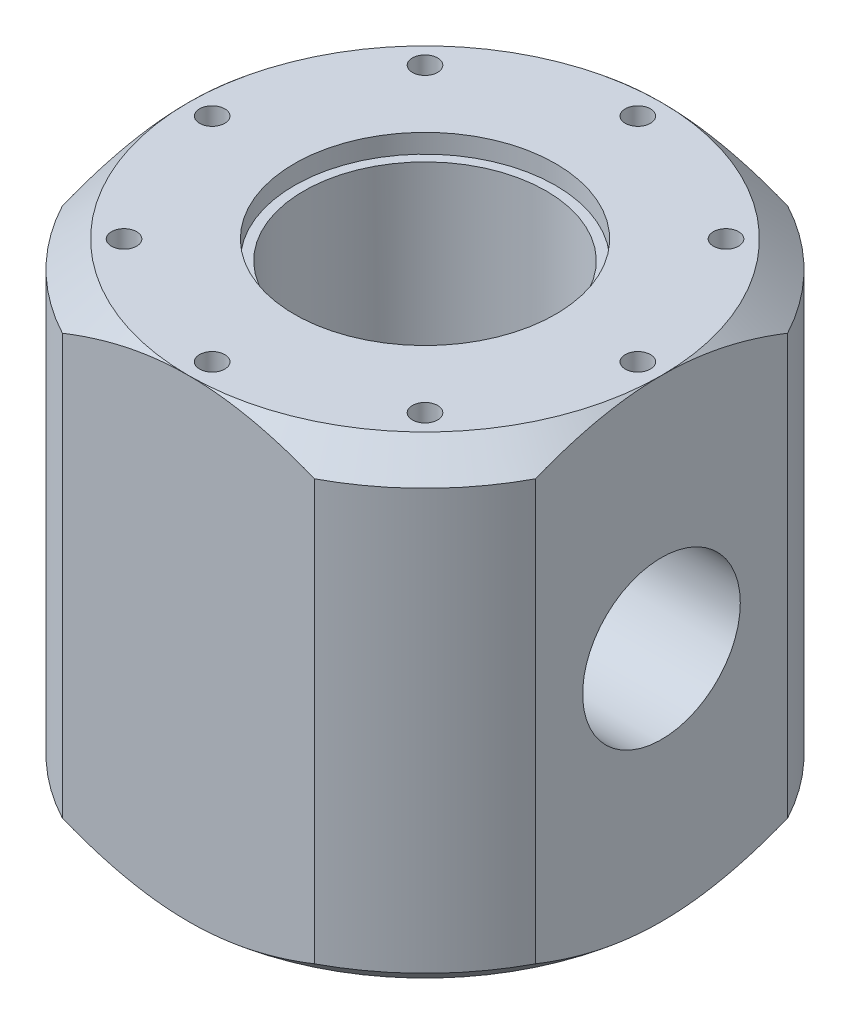
from build123d import *

# Parameters (mm, degrees)
SKETCH1_W               = 75
SKETCH1_H               = 75
BOSS_EXTRUDE1_DEPTH     = 75
SKETCH2_R               = 5.35
CUT_EXTRUDE1_DEPTH      = 92.855865354
SKETCH5_R               = 12.5
CUT_EXTRUDE2_DEPTH      = 113.5
SKETCH7_R               = 20.71
SKETCH7_R_2             = 19.21
CUT_EXTRUDE3_DEPTH      = 3
SKETCH11_R              = 2
CUT_EXTRUDE4_DEPTH      = 10
SKETCH12_OUTSIDE_W      = 102.98
SKETCH12_OUTSIDE_H      = 102.98
SKETCH12_OUTSIDE_R      = 42.5
CUT_EXTRUDE6_DEPTH      = 92.855865477
SKETCH13_R              = 19.21
CUT_EXTRUDE7_DEPTH      = 50
SKETCH16_OUTSIDE_W      = 126.816
SKETCH16_OUTSIDE_H      = 126.816
SKETCH16_OUTSIDE_R      = 37.5
CUT_EXTRUDE8_DEPTH      = 10
CUT_EXTRUDE8_DRAFT      = 50
MIRROR2_COPY_1_SKETCH_W = 126.816
MIRROR2_COPY_1_SKETCH_H = 126.816
MIRROR2_COPY_1_SKETCH_R = 37.5
MIRROR2_COPY_1_DEPTH    = 10
MIRROR2_COPY_1_DRAFT    = 50


with BuildPart() as part:
    # Sketch1 → Boss-Extrude1 (new body)
    with BuildSketch(Plane(origin=(0, 0, 0), x_dir=(1, 0, 0), z_dir=(0, 1, 0))):
        Rectangle(SKETCH1_W, SKETCH1_H)
    extrude(amount=BOSS_EXTRUDE1_DEPTH)

    # Sketch2 → Cut-Extrude1 (cut, through all)
    with BuildSketch(Plane(origin=(0, 0, 0), x_dir=(-1, 0, 0), z_dir=(0, -1, 0))):
        with Locations(Location((0, 0, 0), (0, 0, 90))):
            Circle(SKETCH2_R)
    extrude(amount=-CUT_EXTRUDE1_DEPTH, mode=Mode.SUBTRACT)

    # Sketch5 → Cut-Extrude2 (cut, through all)
    with BuildSketch(Plane(origin=(37.5, 0, 0), x_dir=(0, 0, -1), z_dir=(1, 0, 0))):
        with Locations((0, 37.5)):
            Circle(SKETCH5_R)
    extrude(amount=-CUT_EXTRUDE2_DEPTH, mode=Mode.SUBTRACT)

    # Sketch7 → Cut-Extrude3 (cut)
    with BuildSketch(Plane.XZ):
        with Locations(Location((0, 0, 0), (0, 0, 270))):
            Circle(SKETCH7_R)
        with Locations(Location((0, 0, 0), (0, 0, 270))):
            Circle(SKETCH7_R_2, mode=Mode.SUBTRACT)
    cut_extrude3 = extrude(amount=-CUT_EXTRUDE3_DEPTH, mode=Mode.SUBTRACT)

    # Sketch11 → Cut-Extrude4 (cut)
    with BuildSketch(Plane.XZ):
        with Locations(Location((-33.75, 0, 0), (0, 0, 270))):
            Circle(SKETCH11_R)
        with Locations(Location((-23.864853865, 23.864853865, 0), (0, 0, 270))):
            Circle(SKETCH11_R)
        with Locations(Location((0, 33.75, 0), (0, 0, 270))):
            Circle(SKETCH11_R)
        with Locations(Location((23.864853865, 23.864853865, 0), (0, 0, 270))):
            Circle(SKETCH11_R)
        with Locations(Location((33.75, 0, 0), (0, 0, 270))):
            Circle(SKETCH11_R)
        with Locations(Location((23.864853865, -23.864853865, 0), (0, 0, 270))):
            Circle(SKETCH11_R)
        with Locations(Location((0, -33.75, 0), (0, 0, 270))):
            Circle(SKETCH11_R)
        with Locations(Location((-23.864853865, -23.864853865, 0), (0, 0, 270))):
            Circle(SKETCH11_R)
    cut_extrude4 = extrude(amount=-CUT_EXTRUDE4_DEPTH, mode=Mode.SUBTRACT)

    # Mirror1: Cut-Extrude3, Cut-Extrude4 across plane
    add(cut_extrude3.mirror(Plane.ZX.offset(37.5)), mode=Mode.SUBTRACT)
    add(cut_extrude4.mirror(Plane.ZX.offset(37.5)), mode=Mode.SUBTRACT)

    # Sketch12 outside → Cut-Extrude6 (cut, through all)
    with BuildSketch(Plane.XZ):
        Rectangle(SKETCH12_OUTSIDE_W, SKETCH12_OUTSIDE_H)
        Circle(SKETCH12_OUTSIDE_R, mode=Mode.SUBTRACT)
    extrude(amount=-CUT_EXTRUDE6_DEPTH, mode=Mode.SUBTRACT)

    # Sketch13 → Cut-Extrude7 (cut)
    with BuildSketch(Plane(origin=(0, 75, 0), x_dir=(1, 0, 0), z_dir=(0, 1, 0))):
        with Locations(Location((0, 0, 0), (0, 0, 90))):
            Circle(SKETCH13_R)
    extrude(amount=-CUT_EXTRUDE7_DEPTH, mode=Mode.SUBTRACT)


with BuildPart() as cut_extrude8_tool:
    # Sketch16 outside → Cut-Extrude8 (with draft: the straight prism first)
    with BuildSketch(Plane(origin=(0, 0, 0), x_dir=(1, 0, 0), z_dir=(0, 1, 0))):
        Rectangle(SKETCH16_OUTSIDE_W, SKETCH16_OUTSIDE_H)
        Circle(SKETCH16_OUTSIDE_R, mode=Mode.SUBTRACT)
    extrude(amount=CUT_EXTRUDE8_DEPTH)
    # Cut-Extrude8: the draft: its side faces are tilted about the plane it starts from
    cut_extrude8_sides = [cut_extrude8_tool.faces().sort_by_distance(p)[0] for p in [
        (0, 5, 63.408),
        (63.408, 5, 0),
        (0, 5, -63.408),
        (-63.408, 5, 0),
        (-37.5, 5, 0),
    ]]
    draft(cut_extrude8_sides, Plane(origin=(0, 0, 0), x_dir=(1, 0, 0), z_dir=(0, 1, 0)), CUT_EXTRUDE8_DRAFT)


with BuildPart() as part_1:
    add(part.part)

    # Cut-Extrude8: cut by cut_extrude8_tool
    add(cut_extrude8_tool.part, mode=Mode.SUBTRACT)


with BuildPart() as mirror2_copy_1_tool:
    # Mirror2 copy 1 sketch → Mirror2 copy 1 (with draft: the straight prism first)
    with BuildSketch(Plane.XZ.offset(-75)):
        Rectangle(MIRROR2_COPY_1_SKETCH_W, MIRROR2_COPY_1_SKETCH_H)
        Circle(MIRROR2_COPY_1_SKETCH_R, mode=Mode.SUBTRACT)
    extrude(amount=MIRROR2_COPY_1_DEPTH)
    # Mirror2 copy 1: the draft: its side faces are tilted about the plane it starts from
    mirror2_copy_1_sides = [mirror2_copy_1_tool.faces().sort_by_distance(p)[0] for p in [
        (0, 70, 63.408),
        (63.408, 70, 0),
        (0, 70, -63.408),
        (-63.408, 70, 0),
        (-37.5, 70, 0),
    ]]
    draft(mirror2_copy_1_sides, Plane.XZ.offset(-75), MIRROR2_COPY_1_DRAFT)


with BuildPart() as part_2:
    add(part_1.part)

    # Mirror2 copy 1: cut by mirror2_copy_1_tool
    add(mirror2_copy_1_tool.part, mode=Mode.SUBTRACT)


solid = part_2.part
